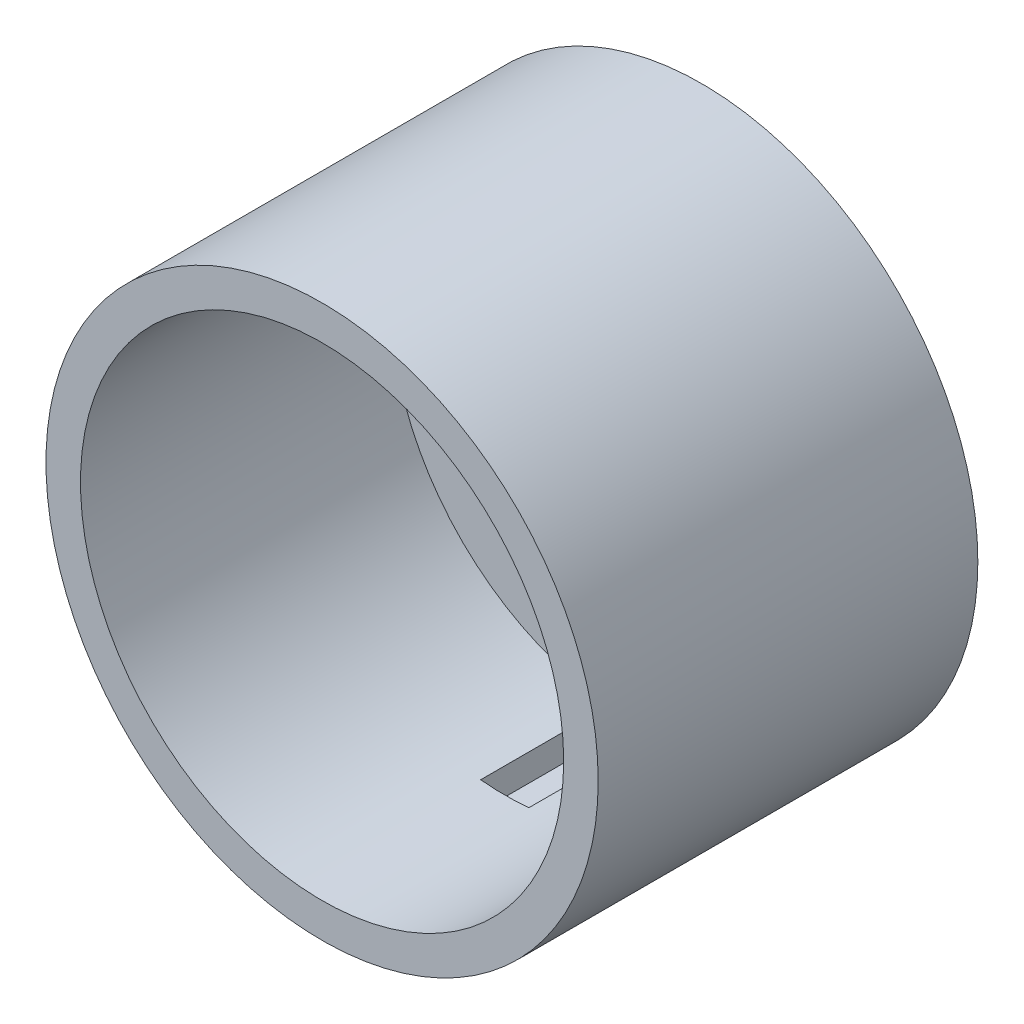
from build123d import *

# Parameters (mm, degrees)
ESQUISSE1_R             = 16
BOSS_EXTRU_1_DEPTH      = 22
ESQUISSE2_W             = 2.8
ESQUISSE2_H             = 31
ENL_V_MAT_EXTRU_1_DEPTH = 11.41
ESQUISSE3_W             = 2.8
ESQUISSE3_H             = 1.7
BOSS_EXTRU_2_DEPTH      = 5
ESQUISSE4_R             = 14
ENL_V_MAT_EXTRU_2_DEPTH = 18


with BuildPart() as part:
    # Esquisse1 → Boss.-Extru.1 (new body)
    with BuildSketch(Plane.XY):
        Circle(ESQUISSE1_R)
    extrude(amount=BOSS_EXTRU_1_DEPTH)

    # Esquisse2 → Enlèv. mat.-Extru.1 (cut)
    with BuildSketch(Plane.XY):
        Rectangle(ESQUISSE2_W, ESQUISSE2_H)
    extrude(amount=ENL_V_MAT_EXTRU_1_DEPTH, mode=Mode.SUBTRACT)

    # Esquisse3 → Boss.-Extru.2 (add)
    with BuildSketch(Plane(origin=(0, 0, 0), x_dir=(-1, 0, 0), z_dir=(0, 0, -1))):
        with Locations((0, 4.15)):
            Rectangle(ESQUISSE3_W, ESQUISSE3_H)
    extrude(amount=-BOSS_EXTRU_2_DEPTH)

    # Esquisse4 → Enlèv. mat.-Extru.2 (cut)
    with BuildSketch(Plane.XY.offset(22)):
        Circle(ESQUISSE4_R)
    extrude(amount=-ENL_V_MAT_EXTRU_2_DEPTH, mode=Mode.SUBTRACT)


solid = part.part
